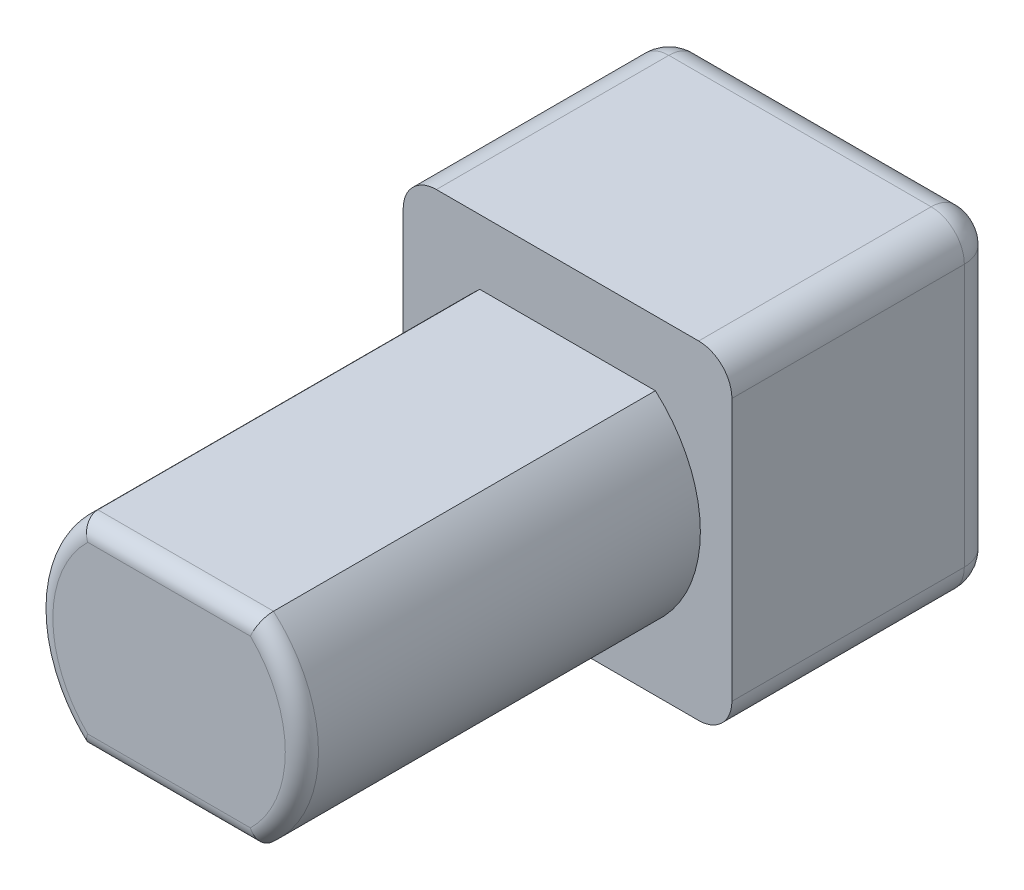
from build123d import *

# Parameters (mm, degrees)
ESQUISSE1_W      = 4.949747468
ESQUISSE1_H      = 4.949747468
EXTRUSION1_DEPTH = 4
EXTRUSION5_DEPTH = 6
CONG_1_R         = 0.5
CONG_2_R         = 0.25


with BuildPart() as part:
    # Esquisse1 → Extrusion1 (new body)
    with BuildSketch(Plane.XY):
        Rectangle(ESQUISSE1_W, ESQUISSE1_H)
    extrude(amount=-EXTRUSION1_DEPTH)

    # Esquisse3 → Extrusion5 (add)
    with BuildSketch(Plane.XY):
        with BuildLine():
            Line((-1.322875656, 1.5), (1.322875656, 1.5))
            ThreePointArc((1.322875656, 1.5), (2, 0), (1.322875656, -1.5))
            Line((1.322875656, -1.5), (-1.322875656, -1.5))
            ThreePointArc((-1.322875656, -1.5), (-2, 0), (-1.322875656, 1.5))
        make_face()
    extrude(amount=EXTRUSION5_DEPTH)

    # Congé1
    cong_1_edges = [part.edges().sort_by_distance(p)[0] for p in [
        (2.474873734, 0, -4),
        (0, 2.474873734, -4),
        (-2.474873734, 0, -4),
        (0, -2.474873734, -4),
        (-2.474873734, 2.474873734, -2),
        (2.474873734, 2.474873734, -2),
        (2.474873734, -2.474873734, -2),
        (-2.474873734, -2.474873734, -2),
    ]]
    fillet(cong_1_edges, radius=CONG_1_R)

    # Congé2
    cong_2_edges = [part.edges().sort_by_distance(p)[0] for p in [
        (-2, 0, 6),
        (0, -1.5, 6),
        (2, 0, 6),
        (0, 1.5, 6),
    ]]
    fillet(cong_2_edges, radius=CONG_2_R)


solid = part.part
